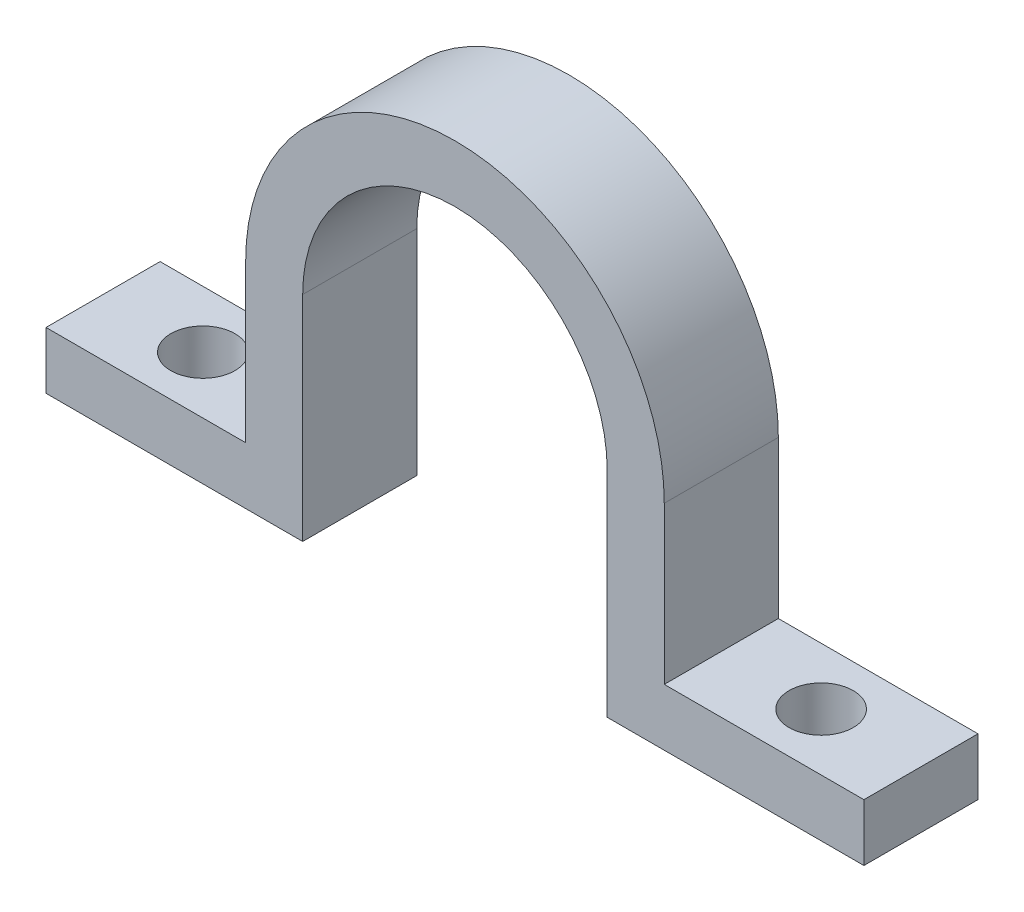
from build123d import *

# Parameters (mm, degrees)
STRAP_DEPTH        = 4
EAR_HOLES_M4_START = -0.5
SKETCH2_R          = 2.25
EAR_HOLES_M4_DEPTH = 5


with BuildPart() as part:
    # Sketch1 → Strap (new, symmetric)
    with BuildSketch(Plane.XY):
        with BuildLine():
            Line((-28.6775, 0), (-10.6775, 0))
            Line((-10.6775, 0), (-10.6775, 15))
            ThreePointArc((-10.6775, 15), (0, 25.6775), (10.6775, 15))
            Line((10.6775, 15), (10.6775, 0))
            Line((10.6775, 0), (28.6775, 0))
            Line((28.6775, 0), (28.6775, 4))
            Line((28.6775, 4), (14.6775, 4))
            Line((14.6775, 4), (14.6775, 15))
            ThreePointArc((14.6775, 15), (0, 29.6775), (-14.6775, 15))
            Line((-14.6775, 15), (-14.6775, 4))
            Line((-14.6775, 4), (-28.6775, 4))
            Line((-28.6775, 4), (-28.6775, 0))
        make_face()
    extrude(amount=STRAP_DEPTH, both=True)

    # Sketch2 → Ear_Holes_M4 (cut)
    with BuildSketch(Plane(origin=(0, 0, 0), x_dir=(1, 0, 0), z_dir=(0, 1, 0)).offset(EAR_HOLES_M4_START)):
        with Locations(Location((-21.6775, 0, 0), (0, 0, 90))):
            Circle(SKETCH2_R)
        with Locations(Location((21.6775, 0, 0), (0, 0, 90))):
            Circle(SKETCH2_R)
    extrude(amount=EAR_HOLES_M4_DEPTH, mode=Mode.SUBTRACT)


solid = part.part
